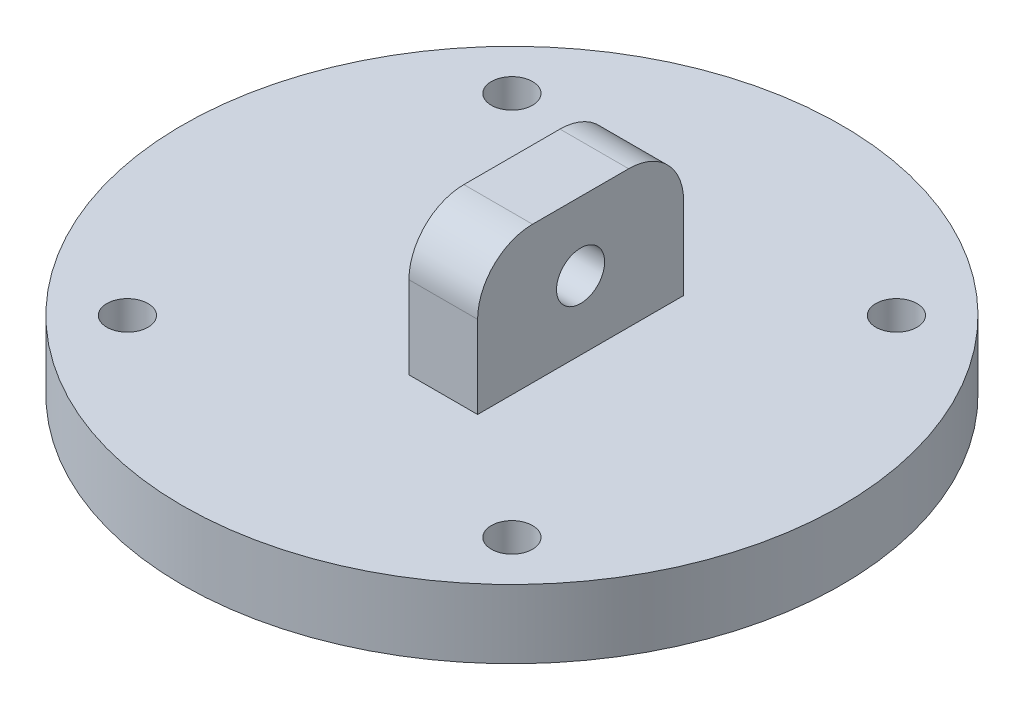
from build123d import *

# Parameters (mm, degrees)
SKETCH_1_R          = 24
EXTRUDE_1_DEPTH     = 5
SKETCH_2_W          = 10
SKETCH_2_H          = 15
EXTRUDE_2_DEPTH     = 15
CUT_EXTRUDE_1_REACH = 42.522
SKETCH_3_R          = 1.75
SKETCH_4_W          = 20
SKETCH_4_H          = 10
CUT_EXTRUDE_2_DEPTH = 5
F_3_0MM_1_D         = 3
FILLET_1_R          = 4


with BuildPart() as part:
    # 草图1 → 凸台-拉伸1 (new body)
    with BuildSketch(Plane(origin=(0, 0, 0), x_dir=(1, 0, 0), z_dir=(0, 1, 0))):
        with Locations(Location((0, 0, 0), (0, 0, 270))):
            Circle(SKETCH_1_R)
    extrude(amount=EXTRUDE_1_DEPTH)

    # 草图2 → 凸台-拉伸2 (add)
    with BuildSketch(Plane(origin=(0, 0, 0), x_dir=(1, 0, 0), z_dir=(0, 1, 0))):
        Rectangle(SKETCH_2_W, SKETCH_2_H)
    extrude(amount=EXTRUDE_2_DEPTH)

    # 草图3 → 切除-拉伸1 (cut, up to next)
    with BuildSketch(Plane.ZY.offset(5), mode=Mode.PRIVATE) as cut_extrude_1_sk1:
        with Locations((0, 10)):
            Circle(SKETCH_3_R)
    cut_extrude_1_tool1 = extrude(cut_extrude_1_sk1.sketch, amount=-CUT_EXTRUDE_1_REACH, mode=Mode.PRIVATE) & part.part
    add(cut_extrude_1_tool1.solids().sort_by_distance((-5, 10, 0))[0], mode=Mode.SUBTRACT)

    # 草图4 → 切除-拉伸2 (cut)
    with BuildSketch(Plane.ZY.offset(5)):
        with Locations((0, 10)):
            Rectangle(SKETCH_4_W, SKETCH_4_H)
    extrude(amount=-CUT_EXTRUDE_2_DEPTH, mode=Mode.SUBTRACT)

    # Ø3.0mm 暗销孔1 (through all)
    with Locations(Plane.XZ):
        with Locations((14, 14), (14, -14), (-14, 14), (-14, -14)):
            Hole(F_3_0MM_1_D / 2)

    # 圆角1
    fillet_1_edges = [part.edges().sort_by_distance(p)[0] for p in [
        (2.5, 15, -7.5),
        (2.5, 15, 7.5),
    ]]
    fillet(fillet_1_edges, radius=FILLET_1_R)


solid = part.part
